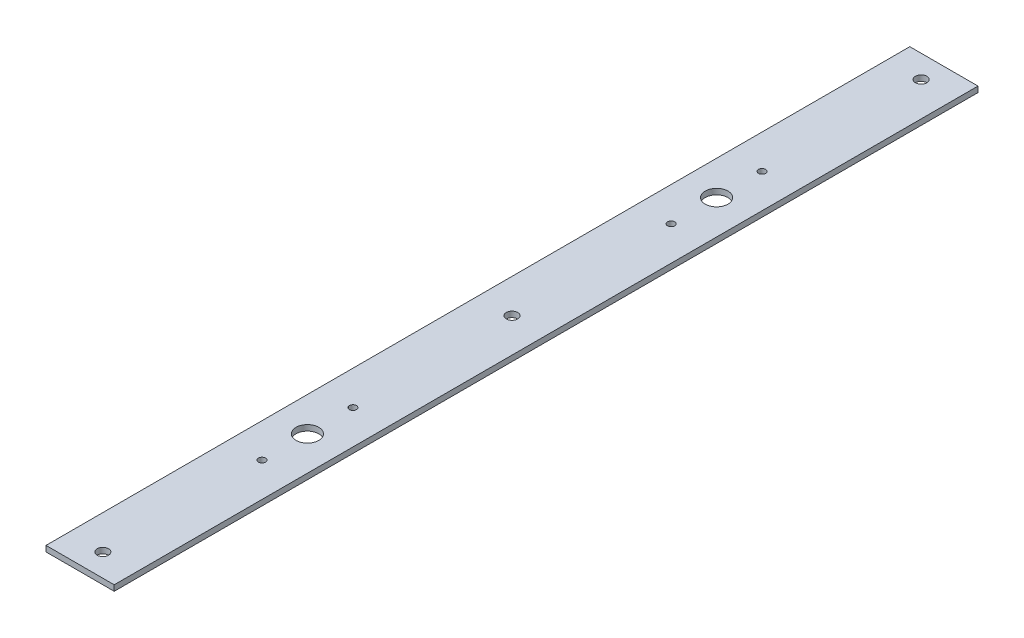
from build123d import *

# Parameters (mm, degrees)
SKETCH1_W        = 38.1
SKETCH1_H        = 482.6
EXTRUSION1_DEPTH = 3.175
HOLE1_D          = 6.35
HOLE2_D          = 12.7
EXTRUSION2_START = -3.175
SKETCH6_R        = 6.35
EXTRUSION2_DEPTH = 3.175
HOLE3_D          = 12.7
HOLE4_D          = 3.96875


with BuildPart() as part:
    # Sketch1 → Extrusion1 (new body)
    with BuildSketch(Plane(origin=(0, 0, 0), x_dir=(-1, 0, 0), z_dir=(0, 1, 0))):
        Rectangle(SKETCH1_W, SKETCH1_H)
    extrude(amount=EXTRUSION1_DEPTH)

    # Hole1 (through all)
    with Locations(Plane(origin=(0, 3.175, 0), x_dir=(1, 0, 0), z_dir=(0, 1, 0))):
        with Locations((0, -228.6), (0, 228.6), (0, 0)):
            Hole(HOLE1_D / 2)

    # Hole2 (through all)
    with Locations(Plane(origin=(0, 3.175, 0), x_dir=(1, 0, 0), z_dir=(0, 1, 0))):
        with Locations((0, -101.6), (0, 101.6)):
            Hole(HOLE2_D / 2)

    # Sketch6 → Extrusion2 (add)
    with BuildSketch(Plane(origin=(0, 3.175, 0), x_dir=(1, 0, 0), z_dir=(0, 1, 0)).offset(EXTRUSION2_START)):
        with Locations((0, -101.6)):
            Circle(SKETCH6_R)
        with Locations((0, 101.6)):
            Circle(SKETCH6_R)
    extrude(amount=EXTRUSION2_DEPTH)

    # Hole3 (through all)
    with Locations(Plane(origin=(0, 3.175, 0), x_dir=(1, 0, 0), z_dir=(0, 1, 0))):
        with Locations((0, 114.3), (0, -114.3)):
            Hole(HOLE3_D / 2)

    # Hole4 (through all)
    with Locations(Plane(origin=(0, 3.175, 0), x_dir=(1, 0, 0), z_dir=(0, 1, 0))):
        with Locations((0, -88.9), (0, -139.7), (0, 88.9), (0, 139.7)):
            Hole(HOLE4_D / 2)


solid = part.part
